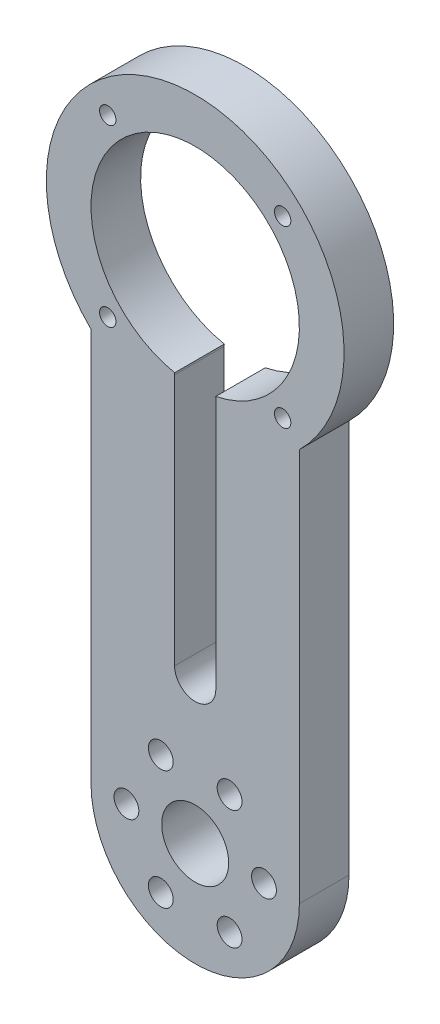
from build123d import *

# Parameters (mm, degrees)
SKETCH1_R           = 6.75
SKETCH1_R_2         = 2.5
SKETCH1_R_3         = 1.65
SKETCH1_R_4         = 1.650080795
BOSS_EXTRUDE2_DEPTH = 10


with BuildPart() as part:
    # Sketch1 → Boss-Extrude2 (new body)
    with BuildSketch(Plane.XY):
        with BuildLine():
            Line((20.227196856, 25.327636264), (20.227196856, -53.948714213))
            ThreePointArc((20.227196856, -53.948714213), (-0.772803144, -74.948714213), (-21.772803144, -53.948714213))
            Line((-21.772803144, -53.948714213), (-21.772803144, 25.327636264))
            ThreePointArc((-21.772803144, 25.327636264), (-0.772803144, 76.751921549), (20.227196856, 25.327636264))
        make_face()
        with Locations((-0.772803144, -53.948714213)):
            Circle(SKETCH1_R, mode=Mode.SUBTRACT)
        with Locations((13.089121207, -53.948714213)):
            Circle(SKETCH1_R_2, mode=Mode.SUBTRACT)
        with Locations((6.158159031, -65.953492847)):
            Circle(SKETCH1_R_2, mode=Mode.SUBTRACT)
        with Locations((-7.703765319, -65.953492847)):
            Circle(SKETCH1_R_2, mode=Mode.SUBTRACT)
        with Locations((-14.634727495, -53.948714213)):
            Circle(SKETCH1_R_2, mode=Mode.SUBTRACT)
        with Locations((-7.703765319, -41.94393558)):
            Circle(SKETCH1_R_2, mode=Mode.SUBTRACT)
        with Locations((6.158159031, -41.94393558)):
            Circle(SKETCH1_R_2, mode=Mode.SUBTRACT)
        with Locations((-18.393960021, 64.373078426)):
            Circle(SKETCH1_R_3, mode=Mode.SUBTRACT)
        with Locations((-18.393960021, 29.130764673)):
            Circle(SKETCH1_R_3, mode=Mode.SUBTRACT)
        with Locations((16.848353733, 29.130764673)):
            Circle(SKETCH1_R_4, mode=Mode.SUBTRACT)
        with Locations((16.848353733, 64.373078426)):
            Circle(SKETCH1_R_3, mode=Mode.SUBTRACT)
        with BuildLine():
            Line((3.381188434, 25.751921549), (3.381188434, -25.007695686))
            ThreePointArc((3.381188434, -25.007695686), (-0.772803144, -29.161687264), (-4.926794722, -25.007695686))
            Line((-4.926794722, -25.007695686), (-4.926794722, 25.751921549))
            ThreePointArc((-4.926794722, 25.751921549), (-4.921699763, 25.957598174), (-4.906427385, 26.162770264))
            ThreePointArc((-4.906427385, 26.162770264), (-0.772803144, 67.751921549), (3.360821097, 26.162770264))
            ThreePointArc((3.360821097, 26.162770264), (3.376093476, 25.957598174), (3.381188434, 25.751921549))
        make_face(mode=Mode.SUBTRACT)
    extrude(amount=BOSS_EXTRUDE2_DEPTH)


solid = part.part
